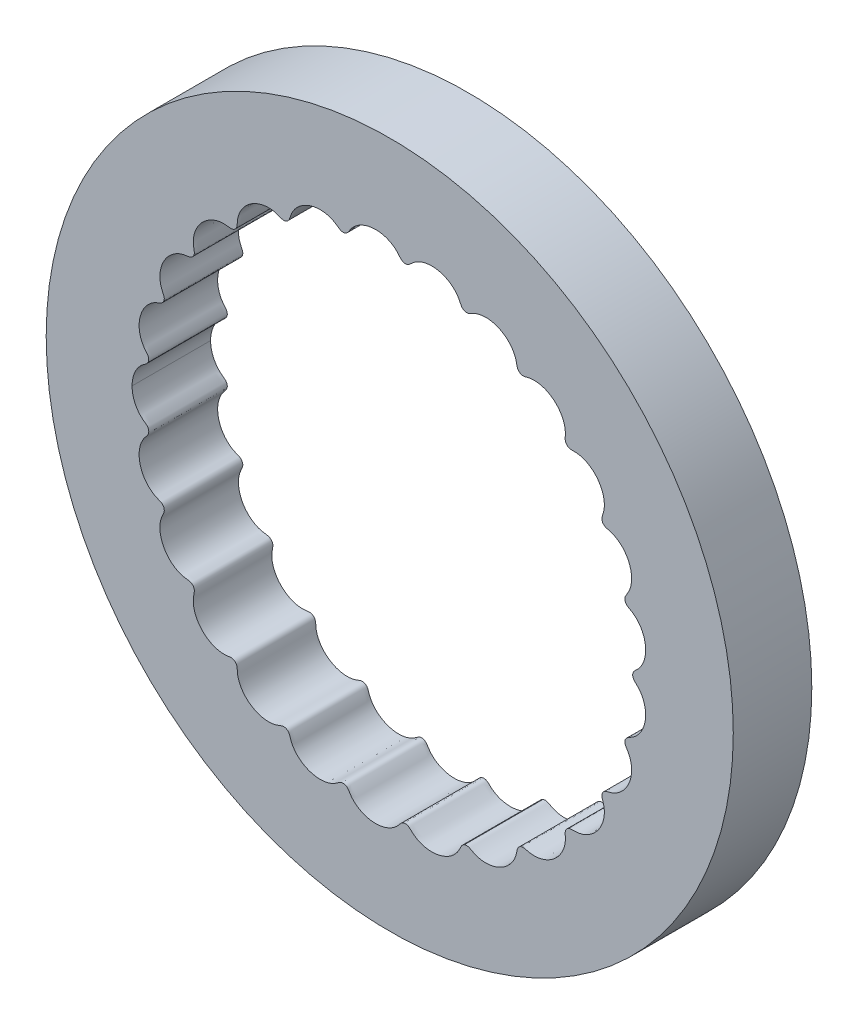
from build123d import *

# Parameters (mm, degrees)
ESQUISSE1_R        = 35
BOSS_EXTRU_1_DEPTH = 8


with BuildPart() as part:
    # Esquisse1 → Boss.-Extru.1 (new body)
    with BuildSketch(Plane.XY):
        Circle(ESQUISSE1_R)
        with BuildLine():
            add(Edge.make_bspline(
                [(24.75, 0), (24.75, -0.01190895), (24.750668659, -0.029768799), (24.75289752, -0.060006713), (24.758884934, -0.104774168), (24.767485304, -0.1467503), (24.785152354, -0.206071411), (24.818482478, -0.284185867), (24.880818803, -0.385919884), (24.984658612, -0.50047292), (25.114781066, -0.616600782), (25.255435339, -0.752464933), (25.419807145, -0.93333087), (25.594989864, -1.169106201), (25.768920192, -1.472936072), (25.920736133, -1.849650866), (26.023477253, -2.249860974), (26.074696747, -2.666946621), (26.073312156, -3.086313852), (26.020370658, -3.501501101), (25.917002683, -3.906273732), (25.764403676, -4.294347485), (25.566224565, -4.654785317), (25.325903213, -4.981499954), (25.081588671, -5.233067427), (24.851914535, -5.418631885), (24.667098284, -5.540217829), (24.539548747, -5.613941762), (24.410179088, -5.684594723), (24.273991814, -5.758046627), (24.120002912, -5.867762768), (23.989867, -6.050335584), (23.936355638, -6.275127193), (23.969192195, -6.495758333), (24.065351302, -6.684284012), (24.178449314, -6.851934675), (24.280144364, -7.019011908), (24.393570042, -7.235347013), (24.503436737, -7.50770452), (24.595094748, -7.84543671), (24.647032867, -8.248159789), (24.645694803, -8.661209862), (24.57595365, -9.185528563), (24.417645445, -9.696077248), (24.174741138, -10.176578568), (23.852030812, -10.610062282), (23.558837347, -10.90980476), (23.24095056, -11.157802847), (22.946586259, -11.329086722), (22.692113519, -11.440823192), (22.472657763, -11.513539342), (22.29388462, -11.561503733), (22.101259895, -11.606028638), (21.902055354, -11.681610724), (21.728453668, -11.828148656), (21.620885016, -12.038837081), (21.601595838, -12.263660858), (21.650481834, -12.469316746), (21.718254479, -12.659791435), (21.774584138, -12.84705718), (21.829677768, -13.084963879), (21.867201208, -13.376160202), (21.870688906, -13.725995236), (21.819474916, -14.128698884), (21.71419458, -14.527993453), (21.514773646, -15.017801417), (21.233133123, -15.4720736), (20.877140734, -15.876030958), (20.455657215, -16.214386724), (20.096354081, -16.430676116), (19.726170583, -16.590569736), (19.398076252, -16.68206281), (19.123633935, -16.725922166), (18.892914818, -16.74091163), (18.707848134, -16.742350192), (18.510091067, -16.737829569), (18.298399992, -16.764443666), (18.095471353, -16.866909122), (17.942147178, -17.047179332), (17.871387572, -17.261366287), (17.870202468, -17.472525416), (17.888313355, -17.673814374), (17.895669209, -17.869207586), (17.888886536, -18.113260777), (17.85168272, -18.404436203), (17.766823301, -18.743754438), (17.615819616, -19.120463832), (17.413434594, -19.48028858), (17.162321288, -19.816819375), (16.868500143, -20.122110223), (16.535786091, -20.390797243), (16.168397966, -20.617282366), (15.771042449, -20.795687849), (15.368766607, -20.914546396), (14.97017149, -20.975982916), (14.629556137, -20.981746846), (14.352921577, -20.954877105), (14.125857036, -20.911170138), (13.94640051, -20.866001244), (13.755772511, -20.812781493), (13.543469889, -20.788894817), (13.322238716, -20.84166807), (13.131407642, -20.981742865), (13.0130413, -21.173627181), (12.961818542, -21.378246364), (12.929064797, -21.57761534), (12.886990745, -21.768547341), (12.818791692, -22.002934942), (12.70930802, -22.275243379), (12.541628211, -22.582120244), (12.300626204, -22.908551746), (12.01422203, -23.205749325), (11.686582401, -23.4681837), (11.325453487, -23.689705246), (10.935854532, -23.866053147), (10.523258626, -23.992837457), (10.093696991, -24.06550579), (9.674368845, -24.079231972), (9.273085465, -24.038208914), (8.941983123, -23.957846351), (8.681067639, -23.861969077), (8.472360468, -23.762392874), (8.310008249, -23.673519219), (8.138322101, -23.574972467), (7.937182673, -23.501849574), (7.704899941, -23.502076627), (7.478095746, -23.600741865), (7.316947907, -23.77285878), (7.220831609, -23.97055906), (7.115634845, -24.203403783), (6.974300377, -24.460401189), (6.773045478, -24.737487424), (6.497851462, -25.02237666), (6.183428844, -25.270910892), (5.835740341, -25.479668636), (5.460328709, -25.645214949), (5.061542815, -25.765601822), (4.644666369, -25.83709061), (4.215744672, -25.855893135), (3.781608585, -25.818103671), (3.372294549, -25.725760832), (2.994169108, -25.584908149), (2.694109042, -25.423555897), (2.465647641, -25.264915254), (2.289085947, -25.115815571), (2.153739497, -24.989104422), (2.012318186, -24.851122457), (1.832423714, -24.733108156), (1.552983355, -24.66593755), (1.26214529, -24.754622086), (1.075414287, -24.957557798), (0.889090341, -25.194134228), (0.69672049, -25.401829912), (0.44758856, -25.61527269), (0.125683965, -25.821812182), (-0.224585626, -25.987068298), (-0.598975616, -26.109092558), (-0.990876156, -26.185347308), (-1.391941275, -26.2145582), (-1.796224618, -26.195837186), (-2.198144681, -26.128499562), (-2.591457519, -26.011923113), (-2.962803429, -25.848997421), (-3.306221845, -25.642423994), (-3.61537583, -25.39483403), (-3.850272783, -25.145621471), (-4.023133112, -24.908691884), (-4.156981332, -24.691054937), (-4.276293257, -24.506578487), (-4.456318725, -24.354528199), (-4.693068775, -24.282897531), (-4.923798246, -24.309710303), (-5.115035952, -24.406102337), (-5.273240645, -24.525178417), (-5.42301226, -24.633920894), (-5.617383402, -24.75923363), (-5.863981708, -24.887558689), (-6.182207181, -25.009385657), (-6.575059912, -25.101071531), (-6.9927825, -25.140689035), (-7.428136381, -25.123106217), (-7.851204623, -25.050059218), (-8.255644199, -24.926289526), (-8.635975215, -24.756290763), (-8.987390026, -24.544434268), (-9.305810055, -24.293211507), (-9.586131065, -24.006734367), (-9.822904508, -23.689158592), (-9.987239236, -23.388704672), (-10.094751199, -23.11580793), (-10.169610451, -22.871508954), (-10.24112571, -22.663502872), (-10.381175345, -22.473662137), (-10.594956363, -22.349311543), (-10.825624608, -22.322047042), (-11.033849204, -22.370890621), (-11.216381876, -22.447371753), (-11.388695767, -22.514940651), (-11.608352834, -22.58716666), (-11.87933894, -22.649041617), (-12.217942215, -22.68664221), (-12.621151131, -22.6763477), (-13.035301253, -22.609509201), (-13.452127793, -22.482943679), (-13.845292771, -22.304868342), (-14.20938889, -22.080540487), (-14.539531306, -21.814993299), (-14.831269767, -21.513076759), (-15.077661765, -21.181891436), (-15.275270226, -20.827454377), (-15.402577207, -20.501715906), (-15.476526159, -20.217667398), (-15.514326563, -19.976485954), (-15.531829272, -19.781749163), (-15.539202372, -19.579813227), (-15.565591069, -19.370421028), (-15.660806856, -19.1659885), (-15.83405536, -19.004717982), (-16.047591105, -18.926560558), (-16.261088064, -18.925182163), (-16.456798489, -18.954287053), (-16.640543184, -18.976331541), (-16.871307425, -18.990807395), (-17.149104778, -18.982241272), (-17.486194881, -18.933211709), (-17.873723074, -18.821638459), (-18.257615968, -18.652692803), (-18.629084532, -18.425342732), (-18.964764813, -18.15411038), (-19.260725449, -17.845401443), (-19.513475385, -17.50529118), (-19.719894943, -17.139574851), (-19.874988153, -16.756923442), (-19.976929286, -16.364037242), (-20.017953734, -16.016642642), (-20.017798024, -15.723070973), (-19.993447495, -15.480115157), (-19.96134753, -15.287225434), (-19.918054975, -15.089779832), (-19.89402871, -14.879875268), (-19.939362883, -14.658860507), (-20.070693635, -14.462043286), (-20.260249499, -14.336679591), (-20.467155514, -14.285214031), (-20.663881817, -14.2650629), (-20.847282484, -14.240161779), (-21.074211831, -14.195950386), (-21.340836688, -14.11751373), (-21.654611423, -13.985047804), (-22.001454707, -13.779432555), (-22.330360371, -13.519308084), (-22.705485211, -13.130240844), (-23.007369545, -12.684411231), (-23.229136266, -12.198075036), (-23.364819327, -11.686883469), (-23.418570267, -11.277399868), (-23.418213213, -10.871399708), (-23.370257339, -10.524800668), (-23.295965049, -10.240716159), (-23.211017087, -10.011726748), (-23.131365089, -9.833119484), (-23.040198426, -9.652618084), (-22.96715924, -9.454144986), (-22.960141523, -9.228680333), (-23.042373084, -9.007208297), (-23.198166311, -8.840665724), (-23.388940312, -8.741382585), (-23.57769294, -8.6722803), (-23.75308195, -8.599853942), (-23.966244513, -8.496298837), (-24.209343816, -8.347711506), (-24.48032477, -8.1355972), (-24.761295108, -7.846344695), (-25.008480075, -7.513349868), (-25.26655565, -7.04900195), (-25.442920247, -6.54763643), (-25.533949151, -6.025561479), (-25.536599067, -5.498854498), (-25.485486947, -5.088916426), (-25.382794666, -4.696000106), (-25.248906316, -4.372612425), (-25.105242941, -4.116427211), (-24.965170858, -3.916248887), (-24.843083512, -3.763442502), (-24.709834093, -3.611215538), (-24.591948067, -3.435387495), (-24.533798882, -3.220620895), (-24.560423715, -2.992589013), (-24.66665443, -2.797016304), (-24.822727104, -2.653701408), (-24.98966356, -2.53926073), (-25.146322188, -2.422077132), (-25.332496393, -2.263776399), (-25.502275925, -2.087254142), (-25.654526877, -1.895838833), (-25.79052351, -1.688263992), (-25.890012472, -1.511998867), (-25.978955887, -1.325507929), (-26.056614781, -1.131467198), (-26.121383307, -0.930707527), (-26.173241314, -0.729759288), (-26.207287779, -0.545661218), (-26.228372118, -0.39585777), (-26.240536879, -0.255725402), (-26.247025958, -0.16909655), (-26.249459241, -0.066739393), (-26.25, -0.022255367), (-26.25, 0)],
                knots=[0.07432085, 0.07432085, 0.07432085, 0.07432085, 0.07432085, 0.074838236, 0.075096929, 0.075355622, 0.075873009, 0.076390395, 0.077425167, 0.07845994, 0.080262761, 0.082065582, 0.083868403, 0.085671224, 0.089276866, 0.092882508, 0.096749545, 0.100616583, 0.104483621, 0.108350658, 0.112188336, 0.116026013, 0.11986369, 0.123701367, 0.12732655, 0.130951733, 0.132764324, 0.134576916, 0.135483211, 0.136389507, 0.138202099, 0.140295775, 0.142389451, 0.144458848, 0.146528245, 0.148330503, 0.150132762, 0.15193502, 0.153737278, 0.157341795, 0.160946311, 0.164812321, 0.16867833, 0.17254434, 0.180415799, 0.184421248, 0.188426697, 0.192432147, 0.195844027, 0.199255907, 0.200961848, 0.202667788, 0.204373728, 0.206079668, 0.208268892, 0.210458115, 0.21252702, 0.214595925, 0.216397713, 0.218199501, 0.220001289, 0.221803077, 0.225406654, 0.22901023, 0.232875219, 0.236740209, 0.240605199, 0.248476586, 0.252482983, 0.25648938, 0.260495777, 0.263907756, 0.267319735, 0.269025725, 0.270731714, 0.272437704, 0.274143693, 0.276335152, 0.278526612, 0.280594702, 0.282662792, 0.284464203, 0.286265613, 0.288067024, 0.289868435, 0.293471257, 0.297074079, 0.300938067, 0.304802055, 0.308666044, 0.312530032, 0.316537343, 0.320544653, 0.324551964, 0.328559274, 0.331971493, 0.335383713, 0.337089822, 0.338795932, 0.340502041, 0.342208151, 0.3444015, 0.346594848, 0.348661829, 0.35072881, 0.352529935, 0.354331061, 0.356132186, 0.357933311, 0.361535562, 0.365137813, 0.369000829, 0.372863844, 0.37672686, 0.380589876, 0.384598055, 0.388606234, 0.392614413, 0.396622592, 0.400035189, 0.403447785, 0.405154083, 0.406860381, 0.408566679, 0.410272977, 0.412467856, 0.414662735, 0.416905332, 0.41914793, 0.420947533, 0.422747136, 0.426346341, 0.429945547, 0.433544752, 0.437320979, 0.441097206, 0.444873433, 0.44864966, 0.452658654, 0.456667648, 0.460676642, 0.464685636, 0.468098738, 0.471511839, 0.473218389, 0.47492494, 0.476631491, 0.478338041, 0.480534086, 0.48273013, 0.487019518, 0.488748834, 0.49047815, 0.493936782, 0.497395414, 0.500854047, 0.504530334, 0.508206621, 0.511882908, 0.515559195, 0.519334982, 0.52311077, 0.526886557, 0.530662345, 0.534261527, 0.537860709, 0.541459892, 0.543259483, 0.545059074, 0.547300663, 0.549542252, 0.55173776, 0.553933267, 0.555639684, 0.5573461, 0.559052517, 0.560758933, 0.564171767, 0.5675846, 0.571593194, 0.575601788, 0.579610382, 0.583618976, 0.587395654, 0.591172332, 0.594949011, 0.598725689, 0.602324954, 0.605924219, 0.609523484, 0.611323117, 0.613122749, 0.615366313, 0.617609877, 0.619804036, 0.621998195, 0.623704391, 0.625410586, 0.627116782, 0.628822977, 0.632235368, 0.635647759, 0.63965551, 0.643663261, 0.647671012, 0.651678763, 0.655542261, 0.659405759, 0.663269257, 0.667132755, 0.670735268, 0.674337782, 0.676139039, 0.677940295, 0.679741552, 0.681542809, 0.683610379, 0.685677949, 0.687870397, 0.690062845, 0.691768886, 0.693474927, 0.695180968, 0.696887009, 0.700299091, 0.703711172, 0.707718031, 0.71172489, 0.715731748, 0.719738607, 0.723603093, 0.727467579, 0.731332066, 0.735196552, 0.738799727, 0.742402903, 0.744204491, 0.746006079, 0.747807667, 0.749609255, 0.751677791, 0.753746327, 0.755936711, 0.758127095, 0.75983305, 0.761539006, 0.763244962, 0.764950918, 0.76836283, 0.771774741, 0.775780668, 0.779786595, 0.783792522, 0.791663947, 0.795529445, 0.799394943, 0.803260441, 0.806864464, 0.810468487, 0.812270499, 0.81407251, 0.815874522, 0.817676533, 0.819745726, 0.821814919, 0.823998833, 0.826182748, 0.827931402, 0.829680057, 0.831428712, 0.833177366, 0.836674676, 0.840171985, 0.844093542, 0.8480151, 0.851936657, 0.859724738, 0.863591261, 0.867457784, 0.871324307, 0.874929364, 0.87853442, 0.880336948, 0.882139476, 0.883942004, 0.885744532, 0.887814048, 0.889883563, 0.891953048, 0.894022532, 0.895825669, 0.897628805, 0.899431941, 0.901235078, 0.90484135, 0.906644487, 0.908447623, 0.910381399, 0.912315175, 0.914248951, 0.916182727, 0.918116503, 0.920050278, 0.921017166, 0.921984054, 0.922950942, 0.92391783, 0.92391783, 0.92391783, 0.92391783, 0.92391783], degree=4))
            add(Edge.make_bspline(
                [(24.75, 0), (24.75, 0.01190895), (24.750668659, 0.029768799), (24.75289752, 0.060006713), (24.758884934, 0.104774168), (24.767485304, 0.1467503), (24.785152354, 0.206071411), (24.818482478, 0.284185867), (24.880818803, 0.385919884), (24.984658612, 0.50047292), (25.114781066, 0.616600782), (25.255435339, 0.752464933), (25.419807145, 0.93333087), (25.594989864, 1.169106201), (25.768920192, 1.472936072), (25.920736133, 1.849650866), (26.023477253, 2.249860974), (26.074696747, 2.666946621), (26.073312156, 3.086313852), (26.020370658, 3.501501101), (25.917002683, 3.906273732), (25.764403676, 4.294347485), (25.566224565, 4.654785317), (25.325903213, 4.981499954), (25.081588671, 5.233067427), (24.851914535, 5.418631885), (24.667098284, 5.540217829), (24.539548747, 5.613941762), (24.410179088, 5.684594723), (24.273991814, 5.758046627), (24.120002912, 5.867762768), (23.989867, 6.050335584), (23.936355638, 6.275127193), (23.969192195, 6.495758333), (24.065351302, 6.684284012), (24.178449314, 6.851934675), (24.280144364, 7.019011908), (24.393570042, 7.235347013), (24.503436737, 7.50770452), (24.595094748, 7.84543671), (24.647032867, 8.248159789), (24.645694803, 8.661209862), (24.57595365, 9.185528563), (24.417645445, 9.696077248), (24.174741138, 10.176578568), (23.852030812, 10.610062282), (23.558837347, 10.90980476), (23.24095056, 11.157802847), (22.946586259, 11.329086722), (22.692113519, 11.440823192), (22.472657763, 11.513539342), (22.29388462, 11.561503733), (22.101259895, 11.606028638), (21.902055354, 11.681610724), (21.728453668, 11.828148656), (21.620885016, 12.038837081), (21.601595838, 12.263660858), (21.650481834, 12.469316746), (21.718254479, 12.659791435), (21.774584138, 12.84705718), (21.829677768, 13.084963879), (21.867201208, 13.376160202), (21.870688906, 13.725995236), (21.819474916, 14.128698884), (21.71419458, 14.527993453), (21.514773646, 15.017801417), (21.233133123, 15.4720736), (20.877140734, 15.876030958), (20.455657215, 16.214386724), (20.096354081, 16.430676116), (19.726170583, 16.590569736), (19.398076252, 16.68206281), (19.123633935, 16.725922166), (18.892914818, 16.74091163), (18.707848134, 16.742350192), (18.510091067, 16.737829569), (18.298399992, 16.764443666), (18.095471353, 16.866909122), (17.942147178, 17.047179332), (17.871387572, 17.261366287), (17.870202468, 17.472525416), (17.888313355, 17.673814374), (17.895669209, 17.869207586), (17.888886536, 18.113260777), (17.85168272, 18.404436203), (17.766823301, 18.743754438), (17.615819616, 19.120463832), (17.413434594, 19.48028858), (17.162321288, 19.816819375), (16.868500143, 20.122110223), (16.535786091, 20.390797243), (16.168397966, 20.617282366), (15.771042449, 20.795687849), (15.368766607, 20.914546396), (14.97017149, 20.975982916), (14.629556137, 20.981746846), (14.352921577, 20.954877105), (14.125857036, 20.911170138), (13.94640051, 20.866001244), (13.755772511, 20.812781493), (13.543469889, 20.788894817), (13.322238716, 20.84166807), (13.131407642, 20.981742865), (13.0130413, 21.173627181), (12.961818542, 21.378246364), (12.929064797, 21.57761534), (12.886990745, 21.768547341), (12.818791692, 22.002934942), (12.70930802, 22.275243379), (12.541628211, 22.582120244), (12.300626204, 22.908551746), (12.01422203, 23.205749325), (11.686582401, 23.4681837), (11.325453487, 23.689705246), (10.935854532, 23.866053147), (10.523258626, 23.992837457), (10.093696991, 24.06550579), (9.674368845, 24.079231972), (9.273085465, 24.038208914), (8.941983123, 23.957846351), (8.681067639, 23.861969077), (8.472360468, 23.762392874), (8.310008249, 23.673519219), (8.138322101, 23.574972467), (7.937182673, 23.501849574), (7.704899941, 23.502076627), (7.478095746, 23.600741865), (7.316947907, 23.772858779), (7.220831609, 23.97055906), (7.115634845, 24.203403783), (6.974300377, 24.460401189), (6.773045477, 24.737487424), (6.497851462, 25.02237666), (6.183428844, 25.270910892), (5.835740341, 25.479668636), (5.460328709, 25.645214949), (5.061542815, 25.765601822), (4.644666369, 25.83709061), (4.215744672, 25.855893135), (3.781608585, 25.818103671), (3.372294549, 25.725760832), (2.994169108, 25.584908149), (2.694109042, 25.423555897), (2.465647641, 25.264915254), (2.289085947, 25.115815571), (2.153739497, 24.989104422), (2.012318186, 24.851122457), (1.832423714, 24.733108156), (1.552983354, 24.66593755), (1.26214529, 24.754622086), (1.075414287, 24.957557798), (0.889090341, 25.194134228), (0.69672049, 25.401829912), (0.44758856, 25.61527269), (0.125683965, 25.821812182), (-0.224585626, 25.987068298), (-0.598975616, 26.109092558), (-0.990876156, 26.185347308), (-1.391941275, 26.2145582), (-1.796224618, 26.195837186), (-2.198144681, 26.128499562), (-2.591457519, 26.011923113), (-2.962803429, 25.848997421), (-3.306221845, 25.642423994), (-3.61537583, 25.39483403), (-3.850272783, 25.145621471), (-4.023133112, 24.908691884), (-4.156981332, 24.691054937), (-4.276293257, 24.506578487), (-4.456318725, 24.354528199), (-4.693068775, 24.282897531), (-4.923798246, 24.309710303), (-5.115035952, 24.406102337), (-5.273240646, 24.525178417), (-5.42301226, 24.633920894), (-5.617383402, 24.75923363), (-5.863981708, 24.887558689), (-6.182207181, 25.009385657), (-6.575059912, 25.101071531), (-6.9927825, 25.140689035), (-7.428136381, 25.123106217), (-7.851204623, 25.050059218), (-8.255644199, 24.926289526), (-8.635975215, 24.756290763), (-8.987390026, 24.544434268), (-9.305810055, 24.293211507), (-9.586131065, 24.006734367), (-9.822904508, 23.689158592), (-9.987239236, 23.388704672), (-10.094751199, 23.11580793), (-10.169610451, 22.871508954), (-10.24112571, 22.663502872), (-10.381175345, 22.473662137), (-10.594956363, 22.349311543), (-10.825624608, 22.322047042), (-11.033849204, 22.370890621), (-11.216381876, 22.447371753), (-11.388695767, 22.514940651), (-11.608352834, 22.58716666), (-11.87933894, 22.649041617), (-12.217942215, 22.68664221), (-12.621151131, 22.676347699), (-13.035301253, 22.609509201), (-13.452127793, 22.482943679), (-13.845292771, 22.304868342), (-14.20938889, 22.080540487), (-14.539531306, 21.814993299), (-14.831269767, 21.513076759), (-15.077661765, 21.181891436), (-15.275270226, 20.827454377), (-15.402577207, 20.501715906), (-15.476526159, 20.217667398), (-15.514326563, 19.976485954), (-15.531829272, 19.781749163), (-15.539202372, 19.579813227), (-15.565591069, 19.370421028), (-15.660806856, 19.1659885), (-15.83405536, 19.004717982), (-16.047591105, 18.926560558), (-16.261088064, 18.925182163), (-16.456798489, 18.954287053), (-16.640543184, 18.976331541), (-16.871307425, 18.990807395), (-17.149104778, 18.982241272), (-17.486194881, 18.933211709), (-17.873723074, 18.821638459), (-18.257615968, 18.652692802), (-18.629084532, 18.425342732), (-18.964764813, 18.15411038), (-19.260725449, 17.845401443), (-19.513475385, 17.50529118), (-19.719894943, 17.139574851), (-19.874988153, 16.756923442), (-19.976929286, 16.364037242), (-20.017953734, 16.016642642), (-20.017798024, 15.723070973), (-19.993447495, 15.480115157), (-19.96134753, 15.287225434), (-19.918054975, 15.089779832), (-19.89402871, 14.879875268), (-19.939362883, 14.658860507), (-20.070693635, 14.462043286), (-20.260249499, 14.336679591), (-20.467155514, 14.285214031), (-20.663881817, 14.2650629), (-20.847282484, 14.240161779), (-21.074211831, 14.195950386), (-21.340836688, 14.11751373), (-21.654611423, 13.985047804), (-22.001454707, 13.779432555), (-22.330360371, 13.519308084), (-22.705485211, 13.130240844), (-23.007369545, 12.684411231), (-23.229136266, 12.198075036), (-23.364819327, 11.686883469), (-23.418570267, 11.277399868), (-23.418213213, 10.871399708), (-23.370257339, 10.524800667), (-23.295965049, 10.240716159), (-23.211017087, 10.011726748), (-23.131365089, 9.833119484), (-23.040198426, 9.652618084), (-22.96715924, 9.454144986), (-22.960141523, 9.228680333), (-23.042373084, 9.007208297), (-23.198166311, 8.840665724), (-23.388940312, 8.741382585), (-23.57769294, 8.6722803), (-23.75308195, 8.599853942), (-23.966244513, 8.496298837), (-24.209343816, 8.347711506), (-24.48032477, 8.1355972), (-24.761295108, 7.846344695), (-25.008480075, 7.513349868), (-25.26655565, 7.04900195), (-25.442920247, 6.54763643), (-25.533949151, 6.025561479), (-25.536599067, 5.498854498), (-25.485486947, 5.088916426), (-25.382794666, 4.696000106), (-25.248906316, 4.372612425), (-25.105242941, 4.116427211), (-24.965170858, 3.916248887), (-24.843083512, 3.763442502), (-24.709834093, 3.611215538), (-24.591948067, 3.435387495), (-24.533798882, 3.220620895), (-24.560423715, 2.992589013), (-24.66665443, 2.797016303), (-24.822727104, 2.653701408), (-24.98966356, 2.53926073), (-25.146322188, 2.422077132), (-25.332496393, 2.263776399), (-25.502275925, 2.087254142), (-25.654526877, 1.895838833), (-25.79052351, 1.688263992), (-25.890012472, 1.511998867), (-25.978955887, 1.325507929), (-26.056614781, 1.131467198), (-26.121383307, 0.930707527), (-26.173241314, 0.729759288), (-26.207287779, 0.545661218), (-26.228372118, 0.39585777), (-26.240536879, 0.255725402), (-26.247025958, 0.16909655), (-26.249459241, 0.066739393), (-26.25, 0.022255367), (-26.25, 0)],
                knots=[0.07432085, 0.07432085, 0.07432085, 0.07432085, 0.07432085, 0.074838236, 0.075096929, 0.075355622, 0.075873009, 0.076390395, 0.077425167, 0.07845994, 0.080262761, 0.082065582, 0.083868403, 0.085671224, 0.089276866, 0.092882508, 0.096749545, 0.100616583, 0.104483621, 0.108350658, 0.112188336, 0.116026013, 0.11986369, 0.123701367, 0.12732655, 0.130951733, 0.132764324, 0.134576916, 0.135483211, 0.136389507, 0.138202099, 0.140295775, 0.142389451, 0.144458848, 0.146528245, 0.148330503, 0.150132762, 0.15193502, 0.153737278, 0.157341795, 0.160946311, 0.164812321, 0.16867833, 0.17254434, 0.180415799, 0.184421248, 0.188426697, 0.192432147, 0.195844027, 0.199255907, 0.200961848, 0.202667788, 0.204373728, 0.206079668, 0.208268892, 0.210458115, 0.21252702, 0.214595925, 0.216397713, 0.218199501, 0.220001289, 0.221803077, 0.225406654, 0.22901023, 0.232875219, 0.236740209, 0.240605199, 0.248476586, 0.252482983, 0.25648938, 0.260495777, 0.263907756, 0.267319735, 0.269025725, 0.270731714, 0.272437704, 0.274143693, 0.276335152, 0.278526612, 0.280594702, 0.282662792, 0.284464203, 0.286265613, 0.288067024, 0.289868435, 0.293471257, 0.297074079, 0.300938067, 0.304802055, 0.308666044, 0.312530032, 0.316537343, 0.320544653, 0.324551964, 0.328559274, 0.331971493, 0.335383713, 0.337089822, 0.338795932, 0.340502041, 0.342208151, 0.3444015, 0.346594848, 0.348661829, 0.35072881, 0.352529935, 0.354331061, 0.356132186, 0.357933311, 0.361535562, 0.365137813, 0.369000829, 0.372863844, 0.37672686, 0.380589876, 0.384598055, 0.388606234, 0.392614413, 0.396622592, 0.400035189, 0.403447785, 0.405154083, 0.406860381, 0.408566679, 0.410272977, 0.412467856, 0.414662735, 0.416905332, 0.41914793, 0.420947533, 0.422747136, 0.426346341, 0.429945547, 0.433544752, 0.437320979, 0.441097206, 0.444873433, 0.44864966, 0.452658654, 0.456667648, 0.460676642, 0.464685636, 0.468098738, 0.471511839, 0.473218389, 0.47492494, 0.476631491, 0.478338041, 0.480534086, 0.48273013, 0.487019518, 0.488748834, 0.49047815, 0.493936782, 0.497395414, 0.500854047, 0.504530334, 0.508206621, 0.511882908, 0.515559195, 0.519334982, 0.52311077, 0.526886557, 0.530662345, 0.534261527, 0.537860709, 0.541459892, 0.543259483, 0.545059074, 0.547300663, 0.549542252, 0.55173776, 0.553933267, 0.555639684, 0.5573461, 0.559052517, 0.560758933, 0.564171767, 0.5675846, 0.571593194, 0.575601788, 0.579610382, 0.583618976, 0.587395654, 0.591172332, 0.594949011, 0.598725689, 0.602324954, 0.605924219, 0.609523484, 0.611323117, 0.613122749, 0.615366313, 0.617609877, 0.619804036, 0.621998195, 0.623704391, 0.625410586, 0.627116782, 0.628822977, 0.632235368, 0.635647759, 0.63965551, 0.643663261, 0.647671012, 0.651678763, 0.655542261, 0.659405759, 0.663269257, 0.667132755, 0.670735268, 0.674337782, 0.676139039, 0.677940295, 0.679741552, 0.681542809, 0.683610379, 0.685677949, 0.687870397, 0.690062845, 0.691768886, 0.693474927, 0.695180968, 0.696887009, 0.700299091, 0.703711172, 0.707718031, 0.71172489, 0.715731748, 0.719738607, 0.723603093, 0.727467579, 0.731332066, 0.735196552, 0.738799727, 0.742402903, 0.744204491, 0.746006079, 0.747807667, 0.749609255, 0.751677791, 0.753746327, 0.755936711, 0.758127095, 0.75983305, 0.761539006, 0.763244962, 0.764950918, 0.76836283, 0.771774741, 0.775780668, 0.779786595, 0.783792522, 0.791663947, 0.795529445, 0.799394943, 0.803260441, 0.806864464, 0.810468487, 0.812270499, 0.81407251, 0.815874522, 0.817676533, 0.819745726, 0.821814919, 0.823998833, 0.826182748, 0.827931402, 0.829680057, 0.831428712, 0.833177366, 0.836674676, 0.840171985, 0.844093542, 0.8480151, 0.851936657, 0.859724738, 0.863591261, 0.867457784, 0.871324307, 0.874929364, 0.87853442, 0.880336948, 0.882139476, 0.883942004, 0.885744532, 0.887814048, 0.889883563, 0.891953048, 0.894022532, 0.895825669, 0.897628805, 0.899431941, 0.901235078, 0.90484135, 0.906644487, 0.908447623, 0.910381399, 0.912315175, 0.914248951, 0.916182727, 0.918116503, 0.920050278, 0.921017166, 0.921984054, 0.922950942, 0.92391783, 0.92391783, 0.92391783, 0.92391783, 0.92391783], degree=4))
        make_face(mode=Mode.SUBTRACT)
    extrude(amount=BOSS_EXTRU_1_DEPTH)


solid = part.part
